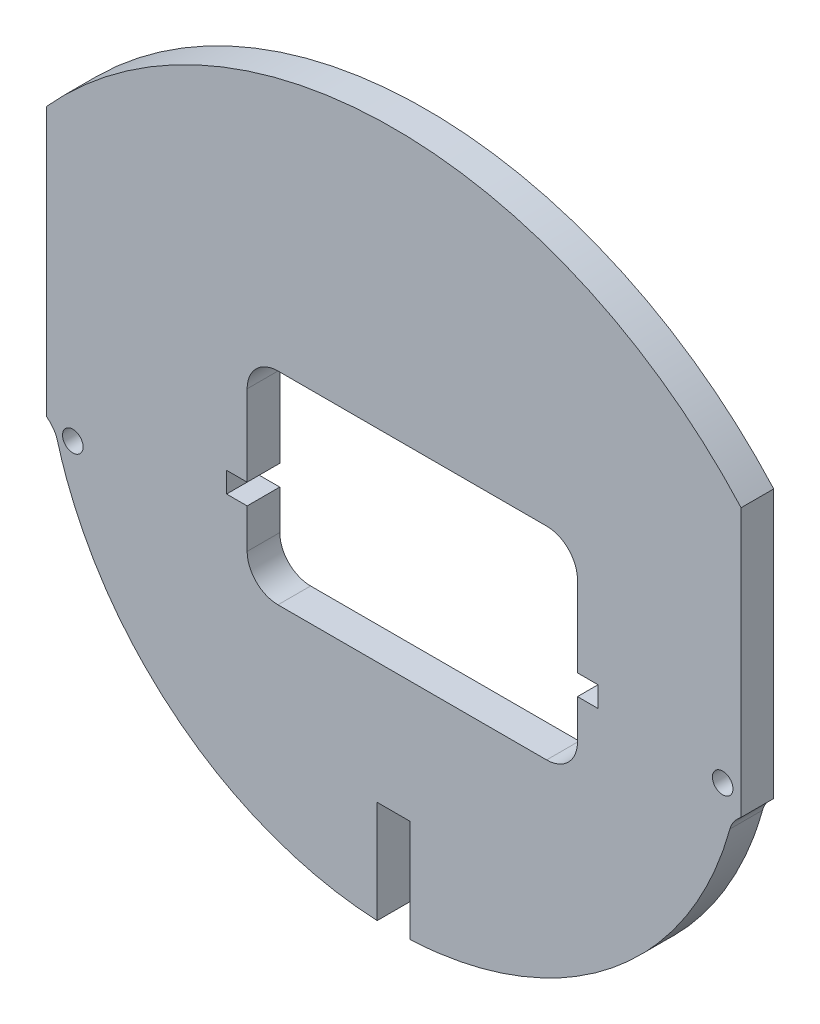
from build123d import *

# Parameters (mm, degrees)
BOSS_EXTRUDE1_DEPTH = 3.175
SKETCH2_R           = 1
CUT_EXTRUDE1_DEPTH  = 3.175
SKETCH3_W           = 3.175
SKETCH3_H           = 10.970571453
CUT_EXTRUDE2_DEPTH  = 48.905483945
SKETCH4_W           = 2
SKETCH4_H           = 2
CUT_EXTRUDE3_DEPTH  = 48.905483945


with BuildPart() as part:
    # Sketch1 → Boss-Extrude1 (new body)
    with BuildSketch(Plane.XY.offset(299.790013628)):
        with BuildLine():
            Line((33.800017398, -7.366761895), (33.800017398, 18.725816778))
            ThreePointArc((33.800017398, 18.725816778), (-0.000557823, 33.799609088), (-33.799982602, 18.723237361))
            Line((-33.799982602, 18.723237361), (-33.799982602, -7.366777732))
            add(Edge.make_bspline(
                [(-33.799982602, -7.366777732), (-33.672789327, -7.463259542), (-33.552121131, -7.566964097), (-33.326159842, -7.79139223), (-33.221125409, -7.912162508), (-33.034465703, -8.166471978), (-32.952054517, -8.300699067), (-32.811712114, -8.585009668), (-32.753980555, -8.735399478), (-32.711505515, -8.889768336)],
                knots=[0, 0, 0, 0, 0.25, 0.25, 0.5, 0.5, 0.75, 0.75, 1, 1, 1, 1], degree=3))
            add(Edge.make_bspline(
                [(-32.711505515, -8.889768336), (-32.218545569, -10.681353815), (-31.582970442, -12.406292143), (-30.046873209, -15.732353364), (-29.149732094, -17.335056266), (-27.853684449, -19.256830618), (-27.585876179, -19.636654103), (-27.037545067, -20.380994298), (-26.194235478, -21.477177142), (-25.289410486, -22.513279461), (-23.400136465, -24.507717332), (-22.036872596, -25.736014695), (-20.198644798, -27.140367507), (-19.823359112, -27.415057973), (-18.307010857, -28.47732838), (-17.130998838, -29.195842865), (-14.299650354, -30.696188469), (-12.615858618, -31.420604816), (-9.99268241, -32.310524634), (-9.099644071, -32.573674181), (-7.309378259, -33.021437293), (-4.607325738, -33.579354316), (-1.855822888, -33.799578534), (7.014e-06, -33.799609106)],
                knots=[0, 0, 0, 0, 0.125, 0.125, 0.25, 0.25, 0.28125, 0.28125, 0.3125, 0.375, 0.375, 0.5, 0.5, 0.53125, 0.53125, 0.625, 0.625, 0.75, 0.75, 0.8125, 0.8125, 0.875, 1, 1, 1, 1], degree=3))
            add(Edge.make_bspline(
                [(7.014e-06, -33.799609106), (3.71198449, -33.799546475), (7.323818522, -33.211894011), (11.272281305, -31.876901766), (11.709255106, -31.719210387), (12.572214597, -31.3883335), (13.853276296, -30.867912798), (16.748236975, -29.483886242), (19.066155809, -28.003005579), (20.904820016, -26.601476418), (21.26870544, -26.312112405), (21.981822477, -25.721047769), (22.331302421, -25.41922276), (23.359250005, -24.495530592), (25.333391288, -22.575468921), (27.05775769, -20.433363088), (28.609537919, -18.137832091), (29.098956145, -17.344856534), (30.005077972, -15.734456147), (30.424297285, -14.914397351), (31.581811664, -12.410251613), (32.218491785, -10.681549287), (32.711505515, -8.889768336)],
                knots=[0, 0, 0, 0, 0.25, 0.25, 0.28125, 0.28125, 0.3125, 0.375, 0.5, 0.5, 0.53125, 0.53125, 0.5625, 0.5625, 0.625, 0.75, 0.75, 0.8125, 0.8125, 0.875, 0.875, 1, 1, 1, 1], degree=3))
            add(Edge.make_bspline(
                [(32.711505515, -8.889768336), (32.79670017, -8.580141747), (32.939002514, -8.296331804), (33.317854255, -7.780583107), (33.545155986, -7.560077249), (33.800017398, -7.366761895)],
                knots=[0, 0, 0, 0, 0.5, 0.5, 1, 1, 1, 1], degree=3))
        make_face()
    extrude(amount=-BOSS_EXTRUDE1_DEPTH)

    # Sketch2 → Cut-Extrude1 (cut)
    with BuildSketch(Plane(origin=(0, 0, 296.615013628), x_dir=(-1, 0, 0), z_dir=(0, 0, -1))):
        with Locations((-32.009302375, -5.358989516)):
            Circle(SKETCH2_R)
        with Locations((31.216064399, -8.164436653)):
            Circle(SKETCH2_R)
    extrude(amount=-CUT_EXTRUDE1_DEPTH, mode=Mode.SUBTRACT)

    # Sketch3 → Cut-Extrude2 (cut, through all)
    with BuildSketch(Plane.XY.offset(299.790013628)):
        with Locations((-0.013127042, -29.284890239)):
            Rectangle(SKETCH3_W, SKETCH3_H)
    extrude(amount=-CUT_EXTRUDE2_DEPTH, mode=Mode.SUBTRACT)

    # Sketch4 → Cut-Extrude3 (cut, through all)
    with BuildSketch(Plane(origin=(0, 0, 296.615013628), x_dir=(-1, 0, 0), z_dir=(0, 0, -1))):
        with BuildLine():
            Line((14.257724699, -8.984256283), (14.257724699, 4.717183699))
            ThreePointArc((14.257724699, 4.717183699), (13.379045042, 6.838504042), (11.257724699, 7.717183699))
            Line((11.257724699, 7.717183699), (-14.878600613, 7.717183699))
            ThreePointArc((-14.878600613, 7.717183699), (-16.999920956, 6.838504042), (-17.878600613, 4.717183699))
            Line((-17.878600613, 4.717183699), (-17.878600613, -8.984256283))
            ThreePointArc((-17.878600613, -8.984256283), (-16.999920956, -11.105576627), (-14.878600613, -11.984256283))
            Line((-14.878600613, -11.984256283), (11.257724699, -11.984256283))
            ThreePointArc((11.257724699, -11.984256283), (13.379045042, -11.105576627), (14.257724699, -8.984256283))
        make_face()
        with Locations((15.257724699, -4.150157902)):
            Rectangle(SKETCH4_W, SKETCH4_H)
        with Locations((-18.878600613, -4.150157902)):
            Rectangle(SKETCH4_W, SKETCH4_H)
    extrude(amount=-CUT_EXTRUDE3_DEPTH, mode=Mode.SUBTRACT)


solid = part.part
